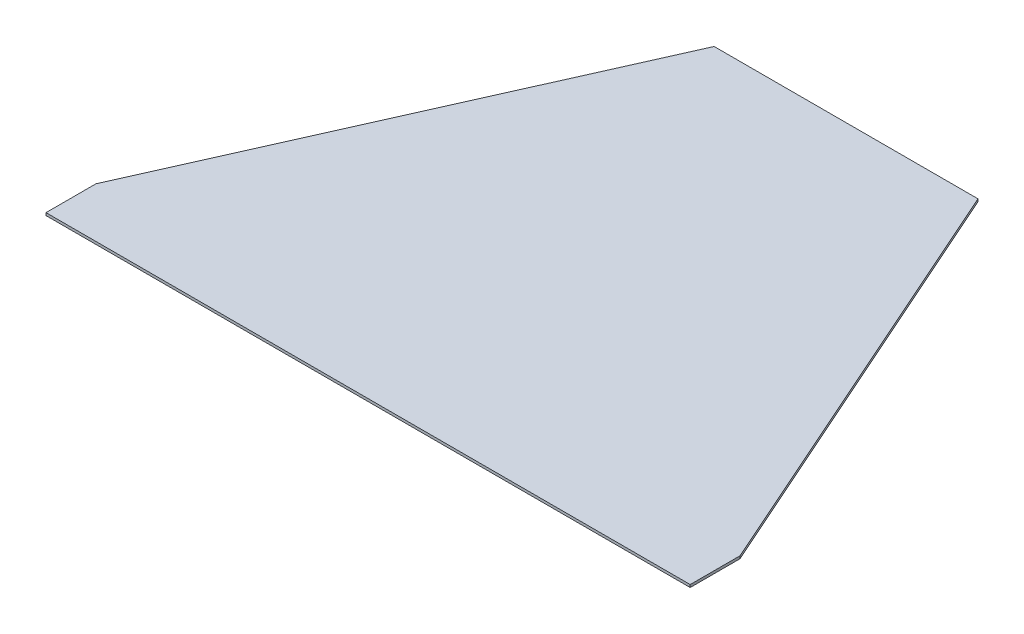
from build123d import *

# Parameters (mm, degrees)
EXTRUDE_1_DEPTH = 5


with BuildPart() as part:
    # 草图1 → 凸台-拉伸1 (new body)
    with BuildSketch(Plane(origin=(0, 0, 0), x_dir=(1, 0, 0), z_dir=(0, 1, 0))):
        Polygon((-620, 0), (620, 0), (620, 96), (254, 920), (-254, 920), (-620, 96), align=None)
    extrude(amount=EXTRUDE_1_DEPTH)


solid = part.part
